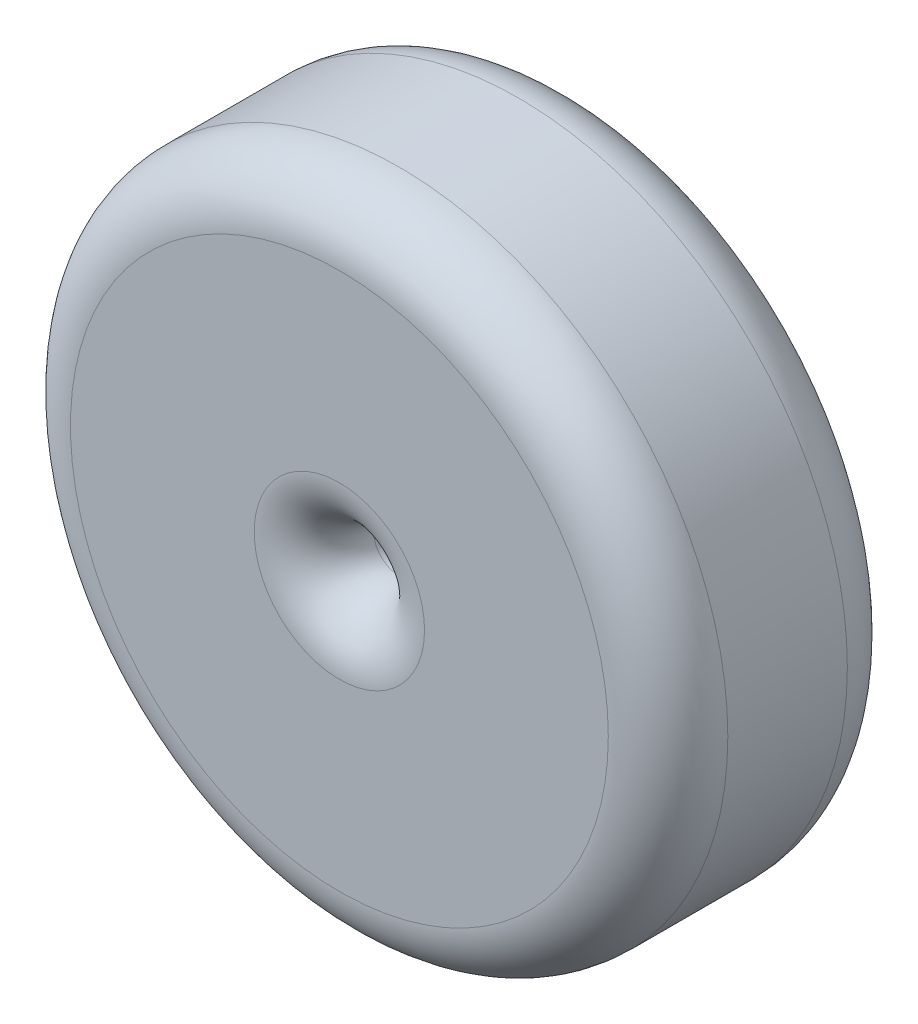
from build123d import *

# Parameters (mm, degrees)
SKETCH_1_R      = 22
SKETCH_1_R_2    = 1.7
EXTRUDE_1_DEPTH = 8
FILLET_1_R      = 4


with BuildPart() as part:
    # 草图1 → 凸台-拉伸1 (new, symmetric)
    with BuildSketch(Plane.XY):
        Circle(SKETCH_1_R)
        Circle(SKETCH_1_R_2, mode=Mode.SUBTRACT)
    extrude(amount=EXTRUDE_1_DEPTH, both=True)

    # 圆角1
    fillet_1_edges = [part.edges().sort_by_distance(p)[0] for p in [
        (-22, 0, -8),
        (-22, 0, 8),
        (-1.7, 0, -8),
        (-1.7, 0, 8),
    ]]
    fillet(fillet_1_edges, radius=FILLET_1_R)


solid = part.part
